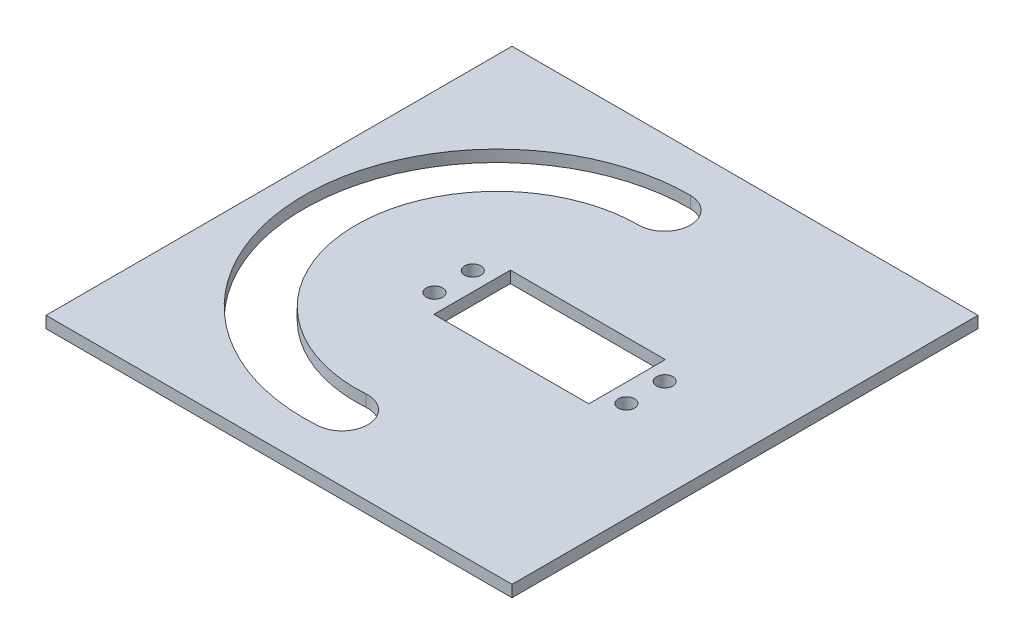
from build123d import *

# Parameters (mm, degrees)
SKETCH1_W           = 140
SKETCH1_H           = 160
BOSS_EXTRUDE1_DEPTH = 3
SKETCH2_W           = 120
SKETCH2_H           = 120
SKETCH2_W_2         = 117
SKETCH2_H_2         = 117
BOSS_EXTRUDE2_DEPTH = 70
SKETCH4_W           = 120
SKETCH4_H           = 120
BOSS_EXTRUDE4_DEPTH = 3
SKETCH5_R           = 2.1
SKETCH5_W           = 39.9
SKETCH5_H           = 19.71
CUT_EXTRUDE2_DEPTH  = 3
SKETCH6_W           = 18.298163042
SKETCH6_H           = 17.309993256
CUT_EXTRUDE3_DEPTH  = 3
CUT_EXTRUDE8_DEPTH  = 5
SKETCH15_W          = 259.021634325
SKETCH15_H          = 180.269434884
BOSS_EXTRUDE5_DEPTH = 3
SKETCH18_R          = 1.6
CUT_EXTRUDE9_DEPTH  = 10
SKETCH19_W          = 12
SKETCH19_H          = 4.5
SKETCH19_H_2        = 8.4
SKETCH19_W_2        = 10.084057066
SKETCH19_H_3        = 7.362028533
CUT_EXTRUDE11_DEPTH = 5
SKETCH20_W          = 298.828856564
SKETCH20_H          = 90.290314023
CUT_EXTRUDE12_DEPTH = 233.259150239
SKETCH21_W          = 285.29336792
SKETCH21_H          = 107.84761331
CUT_EXTRUDE13_DEPTH = 210.645587699


with BuildPart() as part:
    # Sketch1 → Boss-Extrude1 (new body)
    with BuildSketch(Plane(origin=(0, 0, 0), x_dir=(1, 0, 0), z_dir=(0, 1, 0))):
        Rectangle(SKETCH1_W, SKETCH1_H)
    extrude(amount=BOSS_EXTRUDE1_DEPTH)

    # Sketch2 → Boss-Extrude2 (add)
    with BuildSketch(Plane(origin=(0, 3, 0), x_dir=(1, 0, 0), z_dir=(0, 1, 0))):
        Rectangle(SKETCH2_W, SKETCH2_H)
        Rectangle(SKETCH2_W_2, SKETCH2_H_2, mode=Mode.SUBTRACT)
    extrude(amount=BOSS_EXTRUDE2_DEPTH)

    # Sketch4 → Boss-Extrude4 (add)
    with BuildSketch(Plane(origin=(0, 73, 0), x_dir=(1, 0, 0), z_dir=(0, 1, 0))):
        Rectangle(SKETCH4_W, SKETCH4_H)
    extrude(amount=BOSS_EXTRUDE4_DEPTH)

    # Sketch5 → Cut-Extrude2 (cut)
    with BuildSketch(Plane(origin=(0, 76, 0), x_dir=(1, 0, 0), z_dir=(0, 1, 0))):
        with Locations(Location((34.39, -4.925, 0), (0, 0, 270))):
            Circle(SKETCH5_R)
        with Locations(Location((34.39, 4.925, 0), (0, 0, 270))):
            Circle(SKETCH5_R)
        with Locations(Location((-15.03, -4.925, 0), (0, 0, 270))):
            Circle(SKETCH5_R)
        with Locations(Location((-15.03, 4.925, 0), (0, 0, 270))):
            Circle(SKETCH5_R)
        with Locations((9.68, 0)):
            Rectangle(SKETCH5_W, SKETCH5_H)
    extrude(amount=-CUT_EXTRUDE2_DEPTH, mode=Mode.SUBTRACT)

    # Sketch6 → Cut-Extrude3 (cut)
    with BuildSketch(Plane(origin=(0, 76, 0), x_dir=(1, 0, 0), z_dir=(0, 1, 0))):
        Rectangle(SKETCH6_W, SKETCH6_H)
    extrude(amount=-CUT_EXTRUDE3_DEPTH, mode=Mode.SUBTRACT)

    # Sketch13 → Cut-Extrude8 (cut)
    with BuildSketch(Plane(origin=(0, 76, 0), x_dir=(1, 0, 0), z_dir=(0, 1, 0))):
        with BuildLine():
            ThreePointArc((-3.792582359, 49.728765052), (-53.491503795, -1.722579942), (-0.349490011, -49.609426409))
            ThreePointArc((-0.349490011, -49.609426409), (5.82592347, -42.51288634), (-1.270616599, -36.337472859))
            ThreePointArc((-1.270616599, -36.337472859), (-40.195607742, -1.261740085), (-3.792582359, 36.42488497))
            ThreePointArc((-3.792582359, 36.42488497), (2.859357682, 43.076825011), (-3.792582359, 49.728765052))
        make_face()
    extrude(amount=-CUT_EXTRUDE8_DEPTH, mode=Mode.SUBTRACT)

    # Sketch15 → Boss-Extrude5 (add)
    with BuildSketch(Plane(origin=(0, 3, 0), x_dir=(1, 0, 0), z_dir=(0, 1, 0))):
        with Locations((-39.510817163, -10.134717442)):
            Rectangle(SKETCH15_W, SKETCH15_H)
    extrude(amount=-BOSS_EXTRUDE5_DEPTH)

    # Sketch18 → Cut-Extrude9 (cut)
    with BuildSketch(Plane(origin=(0, 3, 0), x_dir=(1, 0, 0), z_dir=(0, 1, 0))):
        with Locations(Location((-55.452, -27.227420358, 0), (0, 0, 270))):
            Circle(SKETCH18_R)
        with Locations(Location((-55.452, 32.208579642, 0), (0, 0, 270))):
            Circle(SKETCH18_R)
        with Locations(Location((4.746, 32.208579642, 0), (0, 0, 270))):
            Circle(SKETCH18_R)
        with Locations(Location((4.746, -27.227420358, 0), (0, 0, 270))):
            Circle(SKETCH18_R)
    extrude(amount=-CUT_EXTRUDE9_DEPTH, mode=Mode.SUBTRACT)

    # Sketch19 → Cut-Extrude11 (cut)
    with BuildSketch(Plane.ZY.offset(60)):
        with Locations((12.367420358, 33)):
            Rectangle(SKETCH19_W, SKETCH19_H)
        with Locations((-11.259414931, 37.2)):
            Rectangle(SKETCH19_W, SKETCH19_H_2)
        with Locations((-28.606781654, 36.742945388)):
            Rectangle(SKETCH19_W_2, SKETCH19_H_3)
    extrude(amount=-CUT_EXTRUDE11_DEPTH, mode=Mode.SUBTRACT)

    # Sketch20 → Cut-Extrude12 (cut, through all)
    with BuildSketch(Plane.XY.offset(60)):
        with Locations((-35.656907555, 27.854842988)):
            Rectangle(SKETCH20_W, SKETCH20_H)
    extrude(amount=-CUT_EXTRUDE12_DEPTH, mode=Mode.SUBTRACT)


with BuildPart() as cut_extrude12_piece_1:
    # of the separate pieces the step leaves, piece 1, a body of its own (cut_extrude12_pieces)
    add(part.part.solids().sort_by_distance((60, 76, 60))[0])


with BuildPart() as cut_extrude12_piece_2:
    # of the separate pieces the step leaves, piece 2, a body of its own (cut_extrude12_pieces)
    add(part.part.solids().sort_by_distance((90, 0, 60))[0])

    # Sketch21 → Cut-Extrude13 (cut, through all)
    with BuildSketch(Plane(origin=(0, 3, 0), x_dir=(1, 0, 0), z_dir=(0, 1, 0))):
        with Locations((-30.056705319, -107.088557651)):
            Rectangle(SKETCH21_W, SKETCH21_H)
    extrude(amount=-CUT_EXTRUDE13_DEPTH, mode=Mode.SUBTRACT)


solid = cut_extrude12_piece_1.part
